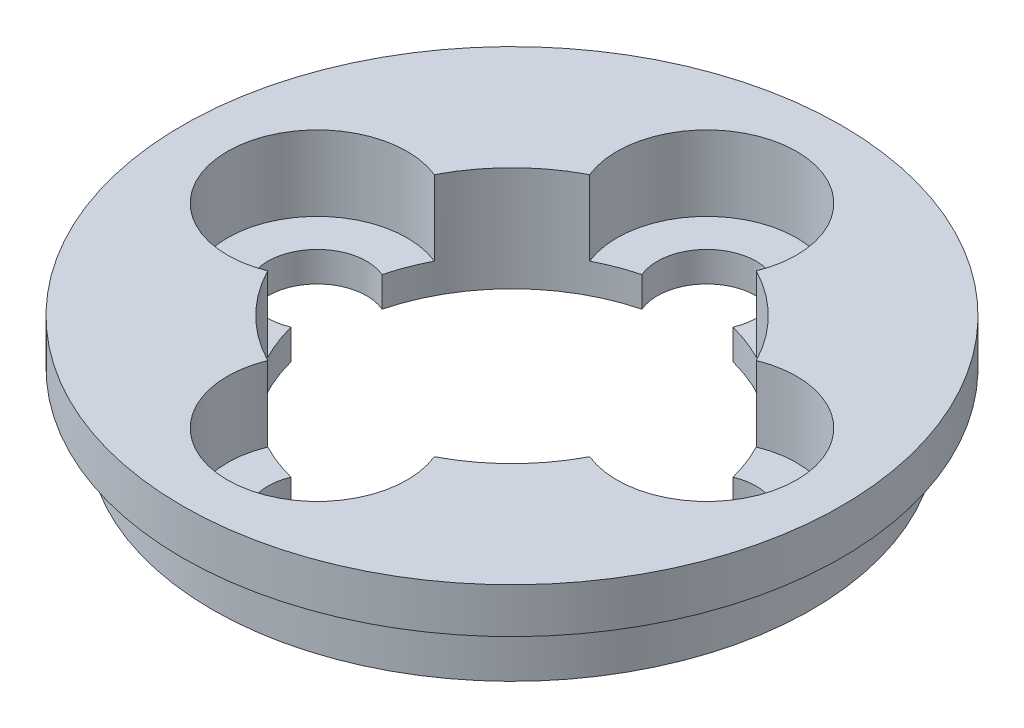
from build123d import *

# Parameters (mm, degrees)
SKETCH_1_R               = 10
SKETCH_1_R_2             = 6.05
EXTRUDE_1_DEPTH          = 2
SKETCH_2_R               = 1.65
CUT_EXTRUDE_1_DEPTH      = 2
PATTERN_CIRCULAR_1_COUNT = 4
SKETCH_3_R               = 11
SKETCH_3_R_2             = 10
EXTRUDE_2_DEPTH          = 1.5
SKETCH_4_R               = 3
CUT_EXTRUDE_2_DEPTH      = 2.5
PATTERN_CIRCULAR_2_COUNT = 4


with BuildPart() as part:
    # 草图1 → 凸台-拉伸1 (new body)
    with BuildSketch(Plane(origin=(0, 0, 0), x_dir=(1, 0, 0), z_dir=(0, 1, 0))):
        with Locations(Location((0, 0, 0), (0, 0, 270))):
            Circle(SKETCH_1_R)
        with Locations(Location((0, 0, 0), (0, 0, 270))):
            Circle(SKETCH_1_R_2, mode=Mode.SUBTRACT)
    extrude(amount=EXTRUDE_1_DEPTH)

    # 草图2 → 切除-拉伸1 (cut)
    with BuildSketch(Plane(origin=(0, 2, 0), x_dir=(1, 0, 0), z_dir=(0, 1, 0))):
        with Locations((-6.5, 0)):
            Circle(SKETCH_2_R)
    cut_extrude_1 = extrude(amount=-CUT_EXTRUDE_1_DEPTH, mode=Mode.SUBTRACT)

    # 阵列(圆周)1: 切除-拉伸1 ×4 about axis
    pattern_circular_1_axis = Axis((0, 0, 0), (0, 1, 0))
    for i in range(1, PATTERN_CIRCULAR_1_COUNT):
        add(cut_extrude_1.rotate(pattern_circular_1_axis, i * 360 / PATTERN_CIRCULAR_1_COUNT), mode=Mode.SUBTRACT)

    # 草图3 → 凸台-拉伸2 (add)
    # profile 1 of 2: a face of its own
    with BuildSketch(Plane(origin=(0, 2, 0), x_dir=(1, 0, 0), z_dir=(0, 1, 0))):
        with Locations(Location((0, 0, 0), (0, 0, 270))):
            Circle(SKETCH_3_R)
        with Locations(Location((0, 0, 0), (0, 0, 270))):
            Circle(SKETCH_3_R_2, mode=Mode.SUBTRACT)
    # profile 2 of 2: a face of its own
    with BuildSketch(Plane(origin=(0, 2, 0), x_dir=(1, 0, 0), z_dir=(0, 1, 0))):
        with Locations(Location((0, 0, 0), (0, 0, 270))):
            Circle(SKETCH_3_R_2)
        with BuildLine():
            ThreePointArc((5.856153846, -1.519197857), (4.277996026, -4.277996026), (1.519197857, -5.856153846))
            ThreePointArc((1.519197857, -5.856153846), (0, -8.15), (-1.519197857, -5.856153846))
            ThreePointArc((-1.519197857, -5.856153846), (-4.277996026, -4.277996026), (-5.856153846, -1.519197857))
            ThreePointArc((-5.856153846, -1.519197857), (-8.15, 0), (-5.856153846, 1.519197857))
            ThreePointArc((-5.856153846, 1.519197857), (-4.277996026, 4.277996026), (-1.519197857, 5.856153846))
            ThreePointArc((-1.519197857, 5.856153846), (0, 8.15), (1.519197857, 5.856153846))
            ThreePointArc((1.519197857, 5.856153846), (4.277996026, 4.277996026), (5.856153846, 1.519197857))
            ThreePointArc((5.856153846, 1.519197857), (8.15, 0), (5.856153846, -1.519197857))
        make_face(mode=Mode.SUBTRACT)
    extrude(amount=EXTRUDE_2_DEPTH)

    # 草图4 → 切除-拉伸2 (cut)
    with BuildSketch(Plane(origin=(0, 3.5, 0), x_dir=(1, 0, 0), z_dir=(0, 1, 0))):
        with Locations((-6.5, 0)):
            Circle(SKETCH_4_R)
    cut_extrude_2 = extrude(amount=-CUT_EXTRUDE_2_DEPTH, mode=Mode.SUBTRACT)

    # 阵列(圆周)2: 切除-拉伸2 ×4 about axis
    pattern_circular_2_axis = Axis((0, 0, 0), (0, 1, 0))
    for i in range(1, PATTERN_CIRCULAR_2_COUNT):
        add(cut_extrude_2.rotate(pattern_circular_2_axis, i * 360 / PATTERN_CIRCULAR_2_COUNT), mode=Mode.SUBTRACT)


solid = part.part
